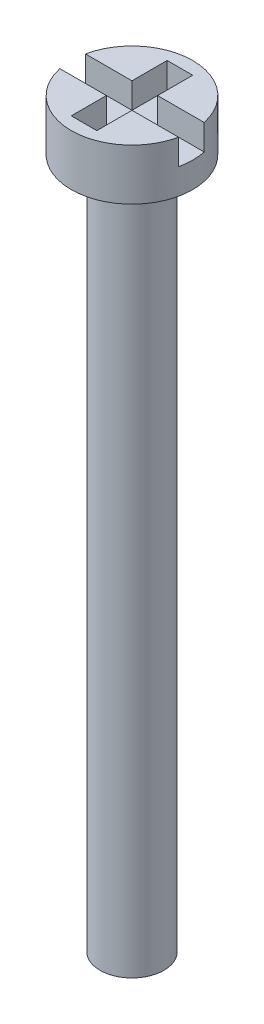
from build123d import *

# Parameters (mm, degrees)
SKETCH_1_R          = 1.25
EXTRUDE_1_DEPTH     = 27
SKETCH_2_R          = 2.375
EXTRUDE_2_DEPTH     = 2
SKETCH_3_W          = 7.004697232
SKETCH_3_H          = 1
CUT_EXTRUDE_1_DEPTH = 1
SKETCH_4_W          = 1
SKETCH_4_H          = 3.75
CUT_EXTRUDE_2_DEPTH = 1


with BuildPart() as part:
    # 草图1 → 拉伸1 (new body)
    with BuildSketch(Plane(origin=(0, 0, 0), x_dir=(1, 0, 0), z_dir=(0, 1, 0))):
        with Locations(Location((0, 0, 0), (0, 0, 270))):
            Circle(SKETCH_1_R)
    extrude(amount=EXTRUDE_1_DEPTH)

    # 草图2 → 拉伸2 (add)
    with BuildSketch(Plane(origin=(0, 27, 0), x_dir=(-1, 0, 0), z_dir=(0, 1, 0))):
        with Locations(Location((0, 0, 0), (0, 0, 90))):
            Circle(SKETCH_2_R)
    extrude(amount=EXTRUDE_2_DEPTH)

    # 草图3 → 切除-拉伸1 (cut)
    with BuildSketch(Plane(origin=(0, 29, 0), x_dir=(-1, 0, 0), z_dir=(0, 1, 0))):
        Rectangle(SKETCH_3_W, SKETCH_3_H)
    extrude(amount=-CUT_EXTRUDE_1_DEPTH, mode=Mode.SUBTRACT)

    # 草图4 → 切除-拉伸2 (cut)
    with BuildSketch(Plane(origin=(0, 29, 0), x_dir=(-1, 0, 0), z_dir=(0, 1, 0))):
        Rectangle(SKETCH_4_W, SKETCH_4_H)
    extrude(amount=-CUT_EXTRUDE_2_DEPTH, mode=Mode.SUBTRACT)


solid = part.part
